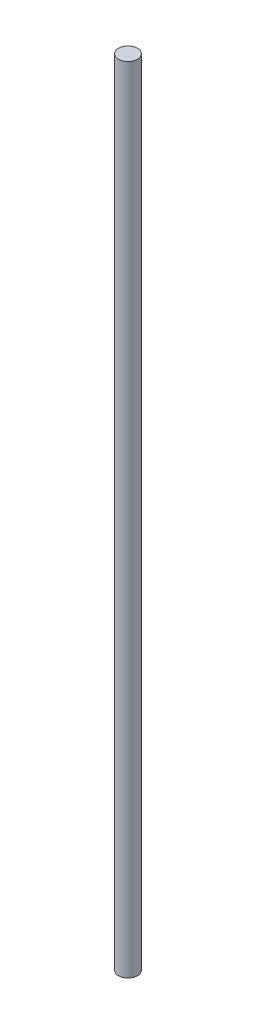
from build123d import *

# Parameters (mm, degrees)
SKETCH2_R           = 1.5
BOSS_EXTRUDE1_DEPTH = 125


with BuildPart() as part:
    # Sketch2 → Boss-Extrude1 (new body)
    with BuildSketch(Plane(origin=(0, 0, 0), x_dir=(1, 0, 0), z_dir=(0, 1, 0))):
        with Locations(Location((0, 0, 0), (0, 0, 270))):
            Circle(SKETCH2_R)
    extrude(amount=BOSS_EXTRUDE1_DEPTH)


solid = part.part
